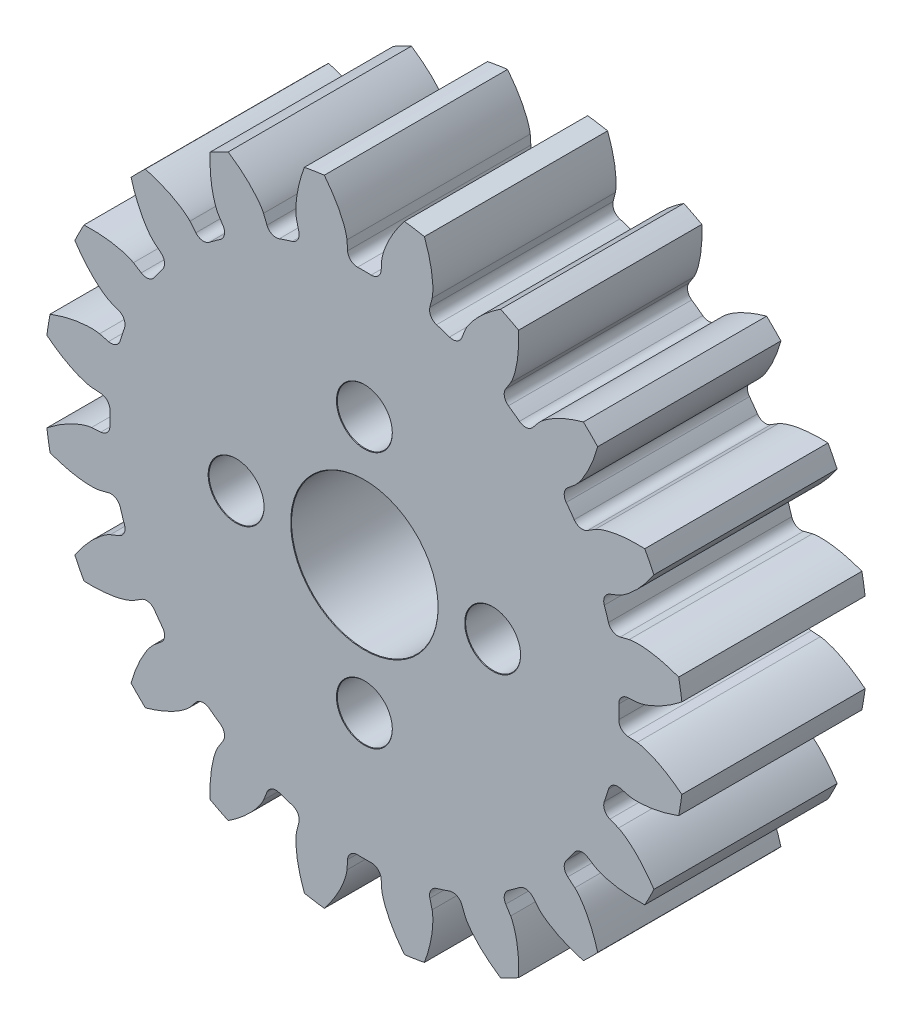
from build123d import *

# Parameters (mm, degrees)
BOSS_EXTRUDE1_DEPTH             = 5
BOSS_EXTRUDE1_DEPTH_BACK        = 5
SKETCH3_R                       = 17.4625
CUT_EXTRUDE1_DEPTH              = 26.196781789
FILLET1_R                       = 0.532614244
CIRPATTERN1_COUNT               = 20
FILLET1_OF_CIRPATTERN1_R        = 0.532614244
F_8_0MM_DOWEL_HOLE1_D           = 8
F_8_0MM_DOWEL_HOLE1_CSINK_D     = 8.05
F_8_0MM_DOWEL_HOLE1_CSINK_ANGLE = 90
F_3_0MM_DOWEL_HOLE1_D           = 3
F_3_0MM_DOWEL_HOLE1_CSINK_D     = 3.05
F_3_0MM_DOWEL_HOLE1_CSINK_ANGLE = 90


with BuildPart() as part:
    # Sketch3 → Boss-Extrude1 (new, two sides: drawn at the far end of the back side and taken through both)
    with BuildSketch(Plane.XY.offset(-BOSS_EXTRUDE1_DEPTH_BACK)):
        Circle(SKETCH3_R)
    extrude(amount=BOSS_EXTRUDE1_DEPTH + BOSS_EXTRUDE1_DEPTH_BACK)

    # Sketch4 → Cut-Extrude1 (cut, symmetric)
    with BuildSketch(Plane.XY):
        with BuildLine():
            Line((13.862509667, 0.883339472), (14.887426331, 0.948648666))
            add(Edge.make_bspline(
                [(14.887426331, 0.948648666), (14.891498563, 0.948960837), (14.902907966, 0.949998784), (14.924427276, 0.952602167), (14.95945375, 0.957759415), (15.003941844, 0.965665547), (15.061257894, 0.977414438), (15.128515995, 0.993219372), (15.202129015, 1.0126422), (15.281861626, 1.035984148), (15.361069319, 1.061221577), (15.439747317, 1.088207697), (15.517806043, 1.116720088), (15.611962192, 1.153177884), (15.724296012, 1.199560006), (15.854707485, 1.257639514), (16.001517137, 1.328059621), (16.14988557, 1.404665091), (16.294820791, 1.484009508), (16.439960894, 1.568702983), (16.579466721, 1.653854051), (16.722947307, 1.746895606), (16.854669468, 1.835118724), (17.000583085, 1.939004457), (17.117858242, 2.024317764), (17.23755882, 2.116622434), (17.295602058, 2.162162412), (17.325173756, 2.185694532)],
                knots=[0, 0, 0, 0, 0, 0.005376749, 0.015083688, 0.02853182, 0.04661014, 0.064854849, 0.092110526, 0.119476176, 0.146842496, 0.174208854, 0.201574956, 0.228941013, 0.256307345, 0.307035032, 0.361767352, 0.416499661, 0.471231937, 0.525964282, 0.580696616, 0.635428982, 0.690161387, 0.744893688, 0.799626082, 0.854358407, 0.909090915, 0.909090915, 0.909090915, 0.909090915, 0.909090915], degree=4))
            ThreePointArc((17.325173756, 2.185694532), (17.4625, 0), (17.325173756, -2.185694532))
            add(Edge.make_bspline(
                [(14.887426331, -0.948648666), (14.891498563, -0.948960837), (14.902907966, -0.949998784), (14.924427276, -0.952602167), (14.95945375, -0.957759415), (15.003941844, -0.965665547), (15.061257894, -0.977414438), (15.128515995, -0.993219372), (15.202129015, -1.0126422), (15.281861626, -1.035984148), (15.361069319, -1.061221577), (15.439747317, -1.088207697), (15.517806043, -1.116720088), (15.611962192, -1.153177884), (15.724296012, -1.199560006), (15.854707485, -1.257639514), (16.001517137, -1.328059621), (16.14988557, -1.404665091), (16.294820791, -1.484009508), (16.439960894, -1.568702983), (16.579466721, -1.653854051), (16.722947307, -1.746895606), (16.854669468, -1.835118724), (17.000583085, -1.939004457), (17.117858242, -2.024317764), (17.23755882, -2.116622434), (17.295602058, -2.162162412), (17.325173756, -2.185694532)],
                knots=[0, 0, 0, 0, 0, 0.005376749, 0.015083688, 0.02853182, 0.04661014, 0.064854849, 0.092110526, 0.119476176, 0.146842496, 0.174208854, 0.201574956, 0.228941013, 0.256307345, 0.307035032, 0.361767352, 0.416499661, 0.471231937, 0.525964282, 0.580696616, 0.635428982, 0.690161387, 0.744893688, 0.799626082, 0.854358407, 0.909090915, 0.909090915, 0.909090915, 0.909090915, 0.909090915], degree=4))
            Line((14.887426331, -0.948648666), (13.862509667, -0.883339472))
            ThreePointArc((13.862509667, -0.883339472), (13.890625, 0), (13.862509667, 0.883339472))
        make_face()
    cut_extrude1 = extrude(amount=CUT_EXTRUDE1_DEPTH, both=True, mode=Mode.SUBTRACT)

    # Fillet1
    fillet1_edges = [part.edges().sort_by_distance(p)[0] for p in [
        (13.862509667, -0.883339472, 0),
        (13.862509667, 0.883339472, 0),
    ]]
    fillet(fillet1_edges, radius=FILLET1_R)

    # CirPattern1: Cut-Extrude1 ×20 about axis
    cirpattern1_axis = Axis((0, 0, 5.000000033), (0, 0, -1))
    for i in range(1, CIRPATTERN1_COUNT):
        add(cut_extrude1.rotate(cirpattern1_axis, i * 360 / CIRPATTERN1_COUNT), mode=Mode.SUBTRACT)

    # Fillet1 of CirPattern1
    fillet1_of_cirpattern1_edges = [part.edges().sort_by_distance(p)[0] for p in [
        (12.911063243, -5.123856832, 0),
        (13.45699706, -3.443645311, 0),
        (10.695791991, -8.862815386, 0),
        (11.734219819, -7.433542098, 0),
        (7.433542098, -11.734219819, 0),
        (8.862815386, -10.695791991, 0),
        (3.443645311, -13.45699706, 0),
        (5.123856832, -12.911063243, 0),
        (-0.883339472, -13.862509667, 0),
        (0.883339472, -13.862509667, 0),
        (-5.123856832, -12.911063243, 0),
        (-3.443645311, -13.45699706, 0),
        (-8.862815386, -10.695791991, 0),
        (-7.433542098, -11.734219819, 0),
        (-11.734219819, -7.433542098, 0),
        (-10.695791991, -8.862815386, 0),
        (-13.45699706, -3.443645311, 0),
        (-12.911063243, -5.123856832, 0),
        (-13.862509667, 0.883339472, 0),
        (-13.862509667, -0.883339472, 0),
        (-12.911063243, 5.123856832, 0),
        (-13.45699706, 3.443645311, 0),
        (-10.695791991, 8.862815386, 0),
        (-11.734219819, 7.433542098, 0),
        (-7.433542098, 11.734219819, 0),
        (-8.862815386, 10.695791991, 0),
        (-3.443645311, 13.45699706, 0),
        (-5.123856832, 12.911063243, 0),
        (0.883339472, 13.862509667, 0),
        (-0.883339472, 13.862509667, 0),
        (5.123856832, 12.911063243, 0),
        (3.443645311, 13.45699706, 0),
        (8.862815386, 10.695791991, 0),
        (7.433542098, 11.734219819, 0),
        (11.734219819, 7.433542098, 0),
        (10.695791991, 8.862815386, 0),
        (13.45699706, 3.443645311, 0),
        (12.911063243, 5.123856832, 0),
    ]]
    fillet(fillet1_of_cirpattern1_edges, radius=FILLET1_OF_CIRPATTERN1_R)

    # Ø8.0mm Dowel Hole1 (through all)
    with Locations(Plane.XY.offset(5.000000033)):
        with Locations((0, 0)):
            CounterSinkHole(F_8_0MM_DOWEL_HOLE1_D / 2, F_8_0MM_DOWEL_HOLE1_CSINK_D / 2, counter_sink_angle=F_8_0MM_DOWEL_HOLE1_CSINK_ANGLE)

    # Ø3.0mm Dowel Hole1 (through all)
    with Locations(Plane.XY.offset(5.000000033)):
        with Locations((0, 7), (7, 0), (0, -7), (-7, 0)):
            CounterSinkHole(F_3_0MM_DOWEL_HOLE1_D / 2, F_3_0MM_DOWEL_HOLE1_CSINK_D / 2, counter_sink_angle=F_3_0MM_DOWEL_HOLE1_CSINK_ANGLE)


solid = part.part
